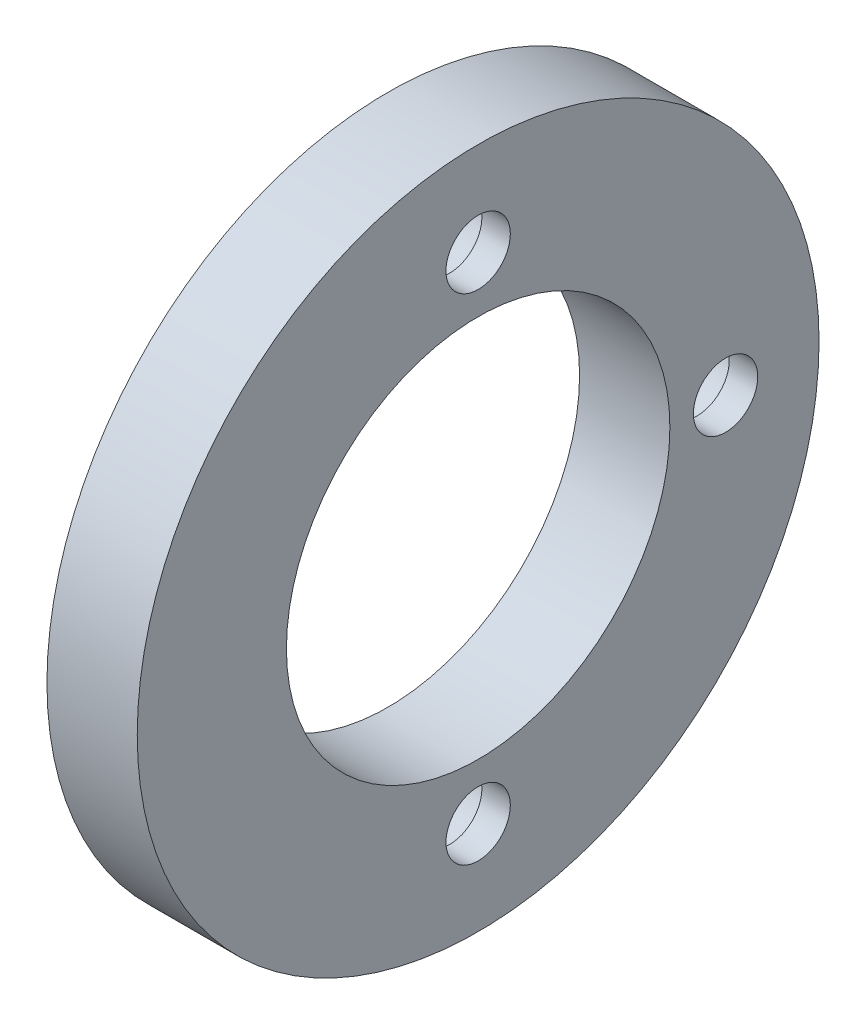
from build123d import *

# Parameters (mm, degrees)
SKETCH1_R           = 35
SKETCH1_R_2         = 19.685
SKETCH1_R_3         = 3.302
BOSS_EXTRUDE1_DEPTH = 9.271
SKETCH2_R           = 4.7625
CUT_EXTRUDE1_DEPTH  = 6.35


with BuildPart() as part:
    # Sketch1 → Boss-Extrude1 (new body)
    with BuildSketch(Plane(origin=(0, 0, 0), x_dir=(0, 0, -1), z_dir=(1, 0, 0))):
        Circle(SKETCH1_R)
        Circle(SKETCH1_R_2, mode=Mode.SUBTRACT)
        with Locations((0, 25.4)):
            Circle(SKETCH1_R_3, mode=Mode.SUBTRACT)
        with Locations((25.4, 0)):
            Circle(SKETCH1_R_3, mode=Mode.SUBTRACT)
        with Locations((0, -25.4)):
            Circle(SKETCH1_R_3, mode=Mode.SUBTRACT)
    extrude(amount=BOSS_EXTRUDE1_DEPTH)

    # Sketch2 → Cut-Extrude1 (cut)
    with BuildSketch(Plane.ZY):
        with Locations((0, 25.4)):
            Circle(SKETCH2_R)
        with Locations((0, -25.4)):
            Circle(SKETCH2_R)
        with Locations((-25.4, 0)):
            Circle(SKETCH2_R)
    extrude(amount=-CUT_EXTRUDE1_DEPTH, mode=Mode.SUBTRACT)


solid = part.part
